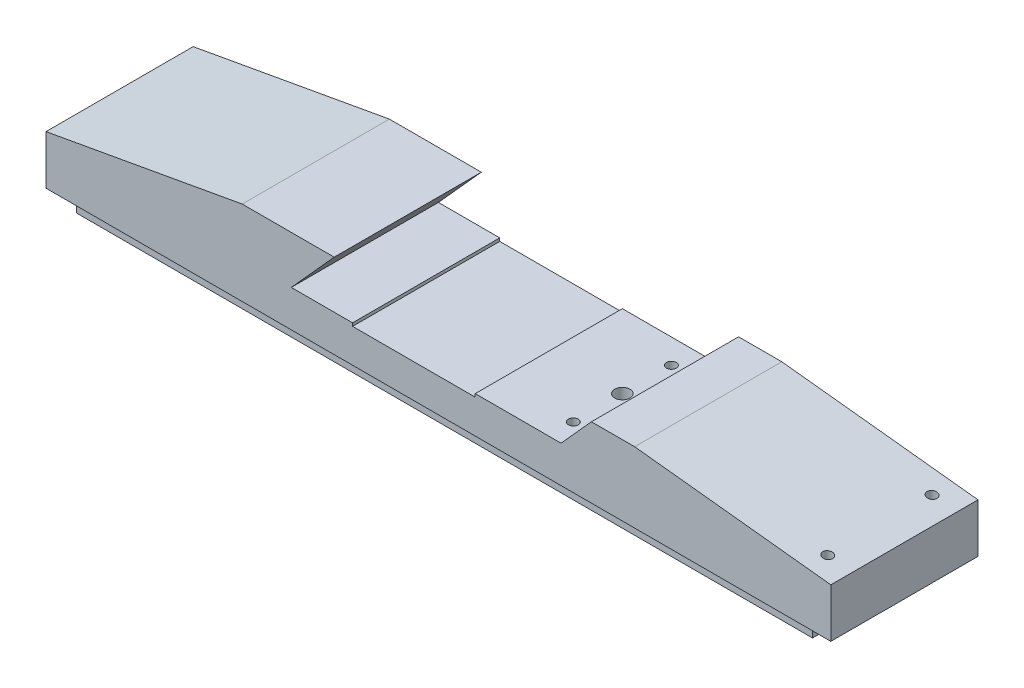
from build123d import *

# Parameters (mm, degrees)
BOSS_EXTRUDE1_DEPTH         = 76.2
SKETCH4_W                   = 25.4
SKETCH4_H                   = 76.2
CUT_EXTRUDE2_DEPTH          = 19.1262
CUT_EXTRUDE9_DEPTH          = 419.232859396
F_1_4_20_TAPPED_HOLE1_D     = 5.1054
F_1_4_20_TAPPED_HOLE1_DEPTH = 12.7
F_1_4_20_TAPPED_HOLE1_TIP   = 1.533816902
F_3_8_16_TAPPED_HOLE1_D     = 7.9375
F_3_8_16_TAPPED_HOLE1_DEPTH = 25.4
F_3_8_16_TAPPED_HOLE1_TIP   = 2.384665582
F_1_4_20_TAPPED_HOLE2_D     = 5.1054
F_1_4_20_TAPPED_HOLE2_DEPTH = 11.1252
F_1_4_20_TAPPED_HOLE2_TIP   = 1.533816902
F_1_4_20_TAPPED_HOLE3_D     = 5.1054


with BuildPart() as part:
    # Sketch2 → Boss-Extrude1 (new body)
    with BuildSketch(Plane.XY):
        Polygon((0, 0), (406.4, 0), (406.4, 44.5262), (304.8, 55.6387), (282.423305624, 55.6387), (266.7, 38.1762), (222.25, 38.1762), (222.25, 36.5887), (158.75, 36.5887), (158.75, 38.1762), (127, 38.1762), (149.225, 62.859563142), (101.6, 62.859563142), (0, 44.5516), align=None)
    extrude(amount=-BOSS_EXTRUDE1_DEPTH)

    # Sketch4 → Cut-Extrude2 (cut)
    with BuildSketch(Plane(origin=(0, 0, 0), x_dir=(-1, 0, 0), z_dir=(0, -1, 0))):
        with Locations((-393.7, 38.1)):
            Rectangle(SKETCH4_W, SKETCH4_H)
    extrude(amount=-CUT_EXTRUDE2_DEPTH, mode=Mode.SUBTRACT)

    # Sketch7 → Cut-Extrude9 (cut, through all)
    with BuildSketch(Plane.ZY):
        Polygon((-76.2, 19.1516), (-76.2, -1.27), (-60.2869, -1.27), (-60.2869, 0.0254), (-60.2869, 9.5504), (-50.7619, 9.5504), (-50.7619, 19.1516), align=None)
        Polygon((-15.9131, 0.0254), (-15.9131, 9.5504), (-25.4381, 9.5504), (-25.4381, 19.1516), (0, 19.1516), (0, -1.27), (-15.9131, -1.27), align=None)
    extrude(amount=-CUT_EXTRUDE9_DEPTH, mode=Mode.SUBTRACT)

    # 1/4-20 Tapped Hole1
    with Locations(Plane(origin=(0, 0, -76.2), x_dir=(-1, 0, 0), z_dir=(0, 0, -1))):
        with Locations((-149.225, 28.6512), (-231.775, 28.6512)):
            Hole(F_1_4_20_TAPPED_HOLE1_D / 2, depth=F_1_4_20_TAPPED_HOLE1_DEPTH)
            with Locations((0, 0, -(F_1_4_20_TAPPED_HOLE1_DEPTH + F_1_4_20_TAPPED_HOLE1_TIP / 2))):  # 118° drill point
                Cone(0, F_1_4_20_TAPPED_HOLE1_D / 2, F_1_4_20_TAPPED_HOLE1_TIP, mode=Mode.SUBTRACT)

    # 3/8-16 Tapped Hole1
    with Locations(Plane(origin=(0, 38.1762, 0), x_dir=(1, 0, 0), z_dir=(0, 1, 0))):
        with Locations((260.35, 38.1)):
            Hole(F_3_8_16_TAPPED_HOLE1_D / 2, depth=F_3_8_16_TAPPED_HOLE1_DEPTH)
            with Locations((0, 0, -(F_3_8_16_TAPPED_HOLE1_DEPTH + F_3_8_16_TAPPED_HOLE1_TIP / 2))):  # 118° drill point
                Cone(0, F_3_8_16_TAPPED_HOLE1_D / 2, F_3_8_16_TAPPED_HOLE1_TIP, mode=Mode.SUBTRACT)

    # 1/4-20 Tapped Hole2
    with Locations(Plane(origin=(0, 38.1762, 0), x_dir=(1, 0, 0), z_dir=(0, 1, 0))):
        with Locations((260.35, 63.5), (260.35, 12.7)):
            Hole(F_1_4_20_TAPPED_HOLE2_D / 2, depth=F_1_4_20_TAPPED_HOLE2_DEPTH)
            with Locations((0, 0, -(F_1_4_20_TAPPED_HOLE2_DEPTH + F_1_4_20_TAPPED_HOLE2_TIP / 2))):  # 118° drill point
                Cone(0, F_1_4_20_TAPPED_HOLE2_D / 2, F_1_4_20_TAPPED_HOLE2_TIP, mode=Mode.SUBTRACT)

    # 1/4-20 Tapped Hole3 (through all)
    with Locations(Plane(origin=(0, 19.1516, 0), x_dir=(-1, 0, 0), z_dir=(0, -1, 0))):
        with Locations((-393.7, 11.1125), (-393.7, 65.0875)):
            Hole(F_1_4_20_TAPPED_HOLE3_D / 2)


solid = part.part
